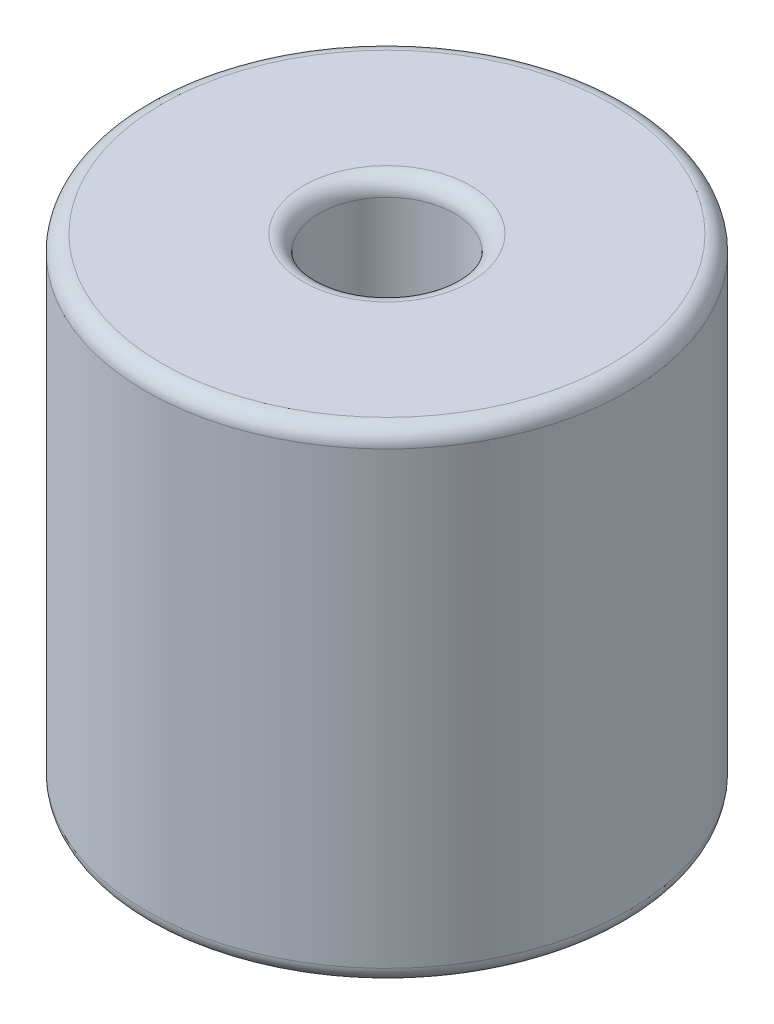
from build123d import *

# Parameters (mm, degrees)
SKETCH1_R           = 7.5
SKETCH1_R_2         = 2.1
BOSS_EXTRUDE1_DEPTH = 15
FILLET1_R           = 0.5


with BuildPart() as part:
    # Sketch1 → Boss-Extrude1 (new body)
    with BuildSketch(Plane(origin=(0, 0, 0), x_dir=(1, 0, 0), z_dir=(0, 1, 0))):
        with Locations(Location((0, 0, 0), (0, 0, 270))):
            Circle(SKETCH1_R)
        with Locations(Location((0, 0, 0), (0, 0, 270))):
            Circle(SKETCH1_R_2, mode=Mode.SUBTRACT)
    extrude(amount=BOSS_EXTRUDE1_DEPTH)

    # Fillet1
    fillet1_edges = [part.edges().sort_by_distance(p)[0] for p in [
        (0, 0, -7.5),
        (0, 15, -7.5),
        (0, 0, -2.1),
        (0, 15, -2.1),
    ]]
    fillet(fillet1_edges, radius=FILLET1_R)


solid = part.part
